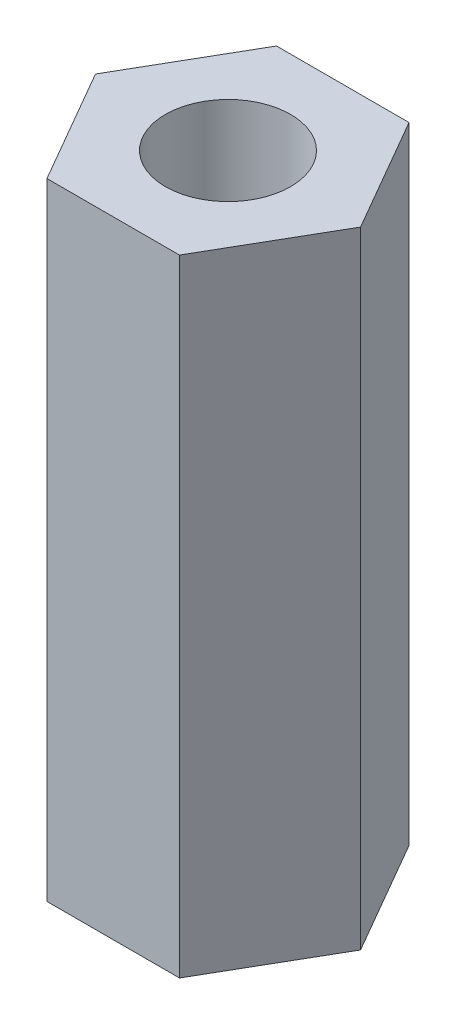
from build123d import *

# Parameters (mm, degrees)
SKETCH1_R           = 1.5
BOSS_EXTRUDE1_DEPTH = 15


with BuildPart() as part:
    # Sketch1 → Boss-Extrude1 (new body)
    with BuildSketch(Plane(origin=(0, 0, 0), x_dir=(1, 0, 0), z_dir=(0, 1, 0))):
        Polygon((-1.58771324, 2.75), (-3.175426481, 0), (-1.58771324, -2.75), (1.58771324, -2.75), (3.175426481, 0), (1.58771324, 2.75), align=None)
        with Locations(Location((0, 0, 0), (0, 0, 270))):
            Circle(SKETCH1_R, mode=Mode.SUBTRACT)
    extrude(amount=BOSS_EXTRUDE1_DEPTH)


solid = part.part
